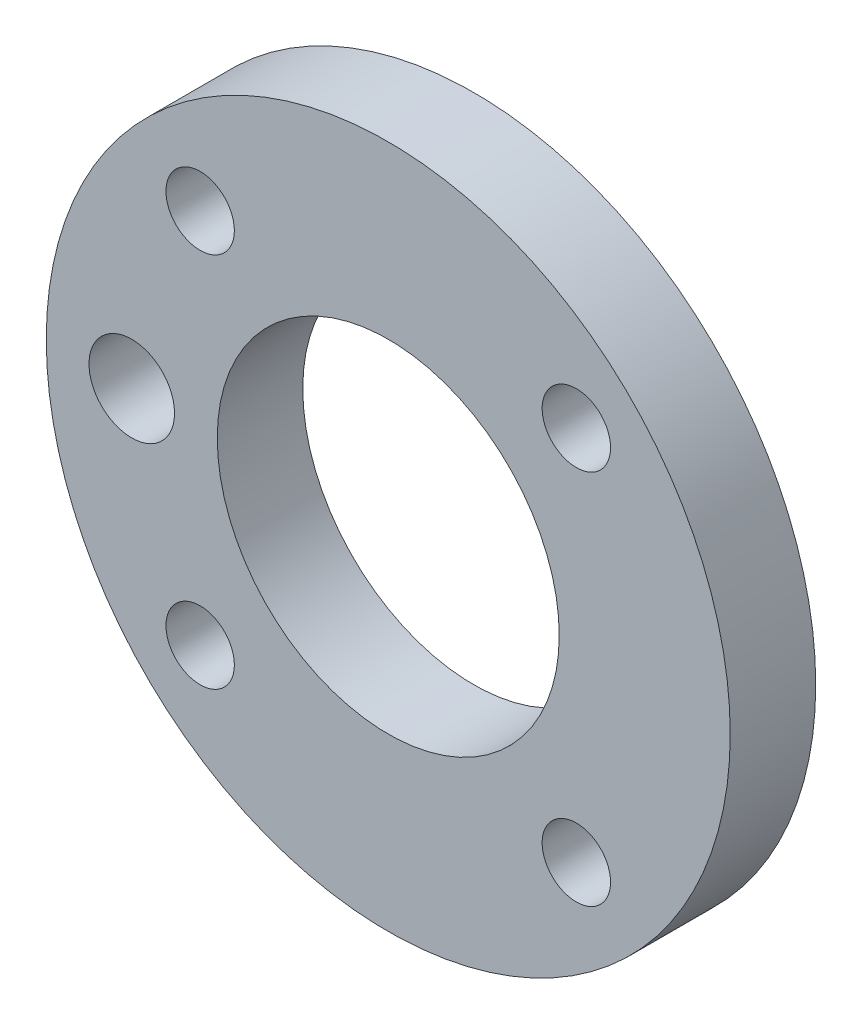
from build123d import *

# Parameters (mm, degrees)
SKETCH1_R           = 20
SKETCH1_R_2         = 10
SKETCH1_R_3         = 2
SKETCH1_R_4         = 2.5
BOSS_EXTRUDE1_DEPTH = 5


with BuildPart() as part:
    # Sketch1 → Boss-Extrude1 (new body)
    with BuildSketch(Plane.XY):
        Circle(SKETCH1_R)
        Circle(SKETCH1_R_2, mode=Mode.SUBTRACT)
        with Locations((-11, 11)):
            Circle(SKETCH1_R_3, mode=Mode.SUBTRACT)
        with Locations((11, 11)):
            Circle(SKETCH1_R_3, mode=Mode.SUBTRACT)
        with Locations((11, -11)):
            Circle(SKETCH1_R_3, mode=Mode.SUBTRACT)
        with Locations((-11, -11)):
            Circle(SKETCH1_R_3, mode=Mode.SUBTRACT)
        with Locations((-15, 0)):
            Circle(SKETCH1_R_4, mode=Mode.SUBTRACT)
    extrude(amount=BOSS_EXTRUDE1_DEPTH)


solid = part.part
